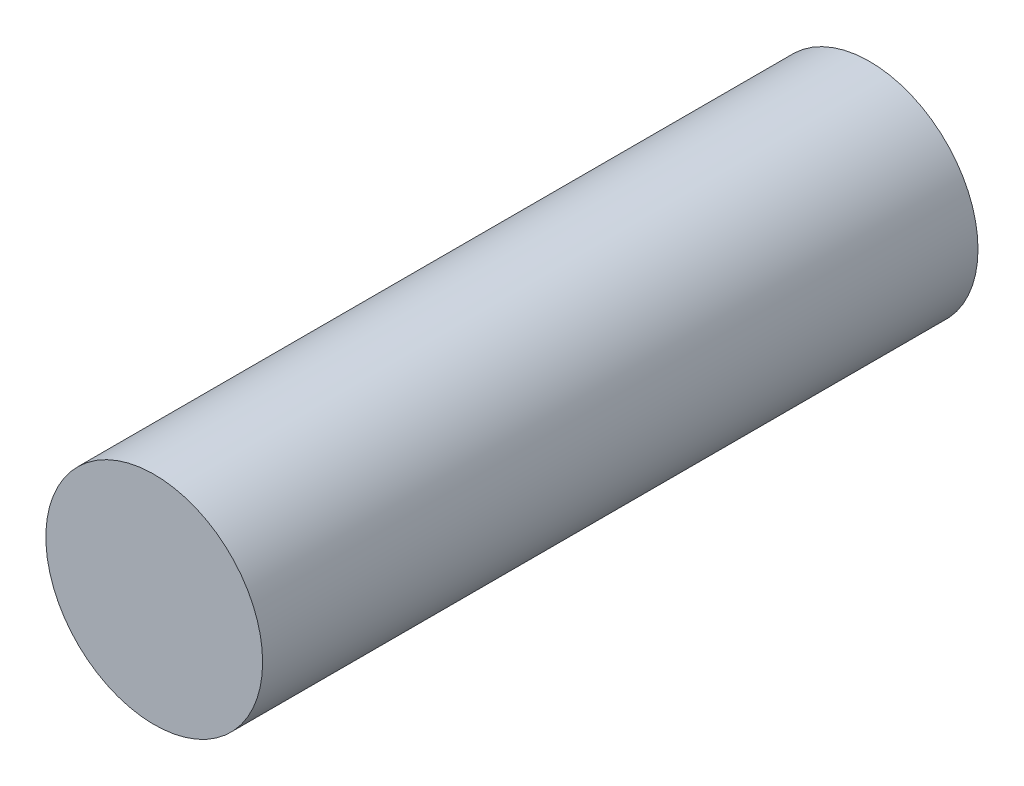
from build123d import *

# Parameters (mm, degrees)
SKETCH2_R           = 10
BOSS_EXTRUDE1_DEPTH = 66


with BuildPart() as part:
    # Sketch2 → Boss-Extrude1 (new body)
    with BuildSketch(Plane.XY):
        Circle(SKETCH2_R)
    extrude(amount=BOSS_EXTRUDE1_DEPTH)


solid = part.part
